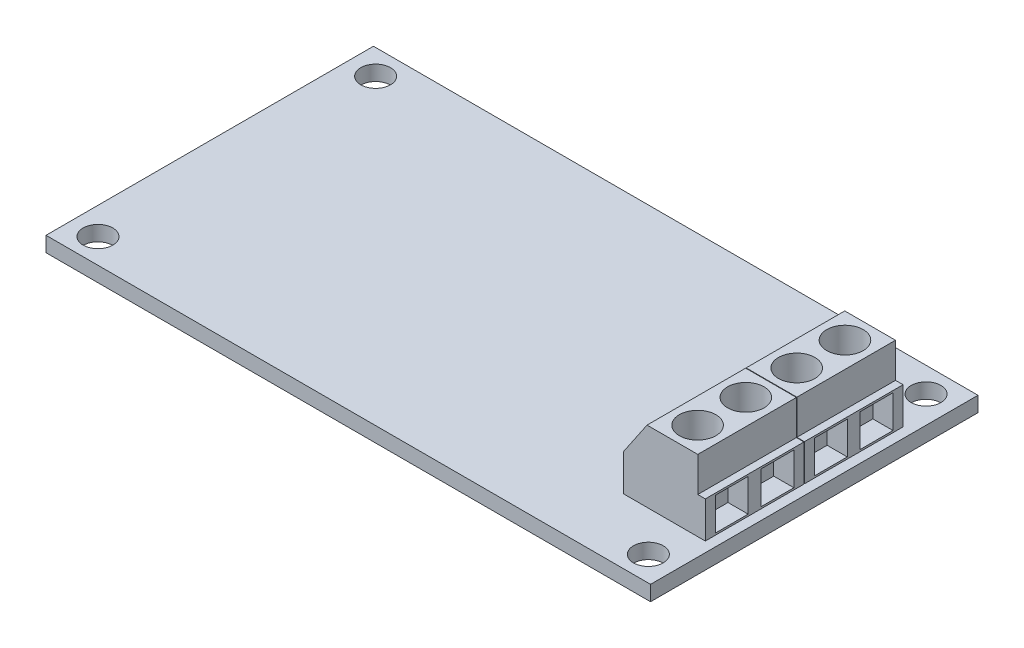
from build123d import *

# Parameters (mm, degrees)
ESQUISSE1_W             = 60.96
ESQUISSE1_H             = 33.02
BOSS_EXTRU_1_DEPTH      = 1.524
ESQUISSE3_W             = 8.255
ESQUISSE3_H             = 9.9695
BOSS_EXTRU_2_DEPTH      = 3.683
BOSS_EXTRU_3_DEPTH      = 3.5052
BOSS_EXTRU_4_DEPTH      = 19.939
ENL_V_START             = -7.1882
ESQUISSE7_W             = 8.255
ESQUISSE7_H             = 0.0508
ENL_V_MAT_EXTRU_1_DEPTH = 7.1882
ESQUISSE8_W             = 3.302
ESQUISSE8_H             = 3.302
ENL_V_MAT_EXTRU_2_DEPTH = 2.032
ESQUISSE9_R             = 1.8415
ENL_V_MAT_EXTRU_3_DEPTH = 3.683
ESQUISSE10_R            = 1.5
ENL_V_MAT_EXTRU_4_DEPTH = 36.401705033


with BuildPart() as part:
    # Esquisse1 → Boss.-Extru.1 (new body)
    with BuildSketch(Plane(origin=(0, 0, 0), x_dir=(1, 0, 0), z_dir=(0, 1, 0))):
        Rectangle(ESQUISSE1_W, ESQUISSE1_H)
    extrude(amount=BOSS_EXTRU_1_DEPTH)

    # Esquisse3 → Boss.-Extru.2 (add)
    with BuildSketch(Plane(origin=(0, 1.524, 0), x_dir=(1, 0, 0), z_dir=(0, 1, 0))):
        with Locations((25.3365, -4.98475)):
            Rectangle(ESQUISSE3_W, ESQUISSE3_H)
        with Locations((25.3365, 4.98475)):
            Rectangle(ESQUISSE3_W, ESQUISSE3_H)
    extrude(amount=BOSS_EXTRU_2_DEPTH)

    # Esquisse5 → Boss.-Extru.3 (add)
    with BuildSketch(Plane(origin=(0, 5.207, 0), x_dir=(1, 0, 0), z_dir=(0, 1, 0))):
        Polygon((28.702, 0), (28.702, 9.9695), (23.586152916, 9.9695), (23.586152916, -9.9695), (28.702, -9.9695), align=None)
    extrude(amount=BOSS_EXTRU_3_DEPTH)

    # Esquisse6 → Boss.-Extru.4 (add)
    with BuildSketch(Plane.XY.offset(9.9695)):
        Polygon((23.586152916, 8.7122), (21.209, 5.207), (23.586152916, 5.207), align=None)
    extrude(amount=-BOSS_EXTRU_4_DEPTH)

    # Esquisse7 → Enlèv. mat.-Extru.1 (cut)
    with BuildSketch(Plane(origin=(0, 8.7122, 0), x_dir=(1, 0, 0), z_dir=(0, 1, 0)).offset(ENL_V_START)):
        with Locations((25.3365, 0)):
            Rectangle(ESQUISSE7_W, ESQUISSE7_H)
    extrude(amount=ENL_V_MAT_EXTRU_1_DEPTH, mode=Mode.SUBTRACT)

    # Esquisse8 → Enlèv. mat.-Extru.2 (cut)
    with BuildSketch(Plane(origin=(29.464, 0, 0), x_dir=(0, 0, -1), z_dir=(1, 0, 0))):
        with Locations((7.3025, 3.3655)):
            Rectangle(ESQUISSE8_W, ESQUISSE8_H)
        with Locations((2.6924, 3.3655)):
            Rectangle(ESQUISSE8_W, ESQUISSE8_H)
        with Locations((-7.3025, 3.3655)):
            Rectangle(ESQUISSE8_W, ESQUISSE8_H)
        with Locations((-2.6924, 3.3655)):
            Rectangle(ESQUISSE8_W, ESQUISSE8_H)
    extrude(amount=-ENL_V_MAT_EXTRU_2_DEPTH, mode=Mode.SUBTRACT)

    # Esquisse9 → Enlèv. mat.-Extru.3 (cut)
    with BuildSketch(Plane(origin=(0, 8.7122, 0), x_dir=(1, 0, 0), z_dir=(0, 1, 0))):
        with Locations(Location((26.144076458, 7.4295, 0), (0, 0, 270))):
            Circle(ESQUISSE9_R)
        with Locations(Location((26.144076458, 2.5654, 0), (0, 0, 90))):
            Circle(ESQUISSE9_R)
        with Locations(Location((26.144076458, -2.5654, 0), (0, 0, 270))):
            Circle(ESQUISSE9_R)
        with Locations(Location((26.144076458, -7.4295, 0), (0, 0, 90))):
            Circle(ESQUISSE9_R)
    extrude(amount=-ENL_V_MAT_EXTRU_3_DEPTH, mode=Mode.SUBTRACT)

    # Esquisse10 → Enlèv. mat.-Extru.4 (cut, through all)
    with BuildSketch(Plane(origin=(0, 1.524, 0), x_dir=(1, 0, 0), z_dir=(0, 1, 0))):
        with Locations(Location((-27.75, 14, 0), (0, 0, 270))):
            Circle(ESQUISSE10_R)
        with Locations(Location((27.75, 14, 0), (0, 0, 270))):
            Circle(ESQUISSE10_R)
        with Locations(Location((27.75, -14, 0), (0, 0, 270))):
            Circle(ESQUISSE10_R)
        with Locations(Location((-27.75, -14, 0), (0, 0, 270))):
            Circle(ESQUISSE10_R)
    extrude(amount=-ENL_V_MAT_EXTRU_4_DEPTH, mode=Mode.SUBTRACT)


solid = part.part
